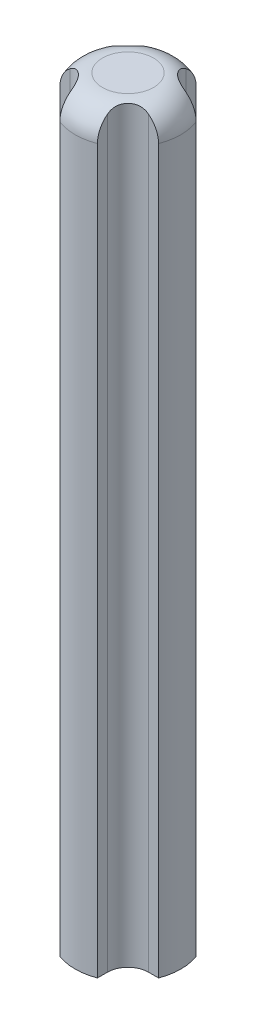
from build123d import *

# Parameters (mm, degrees)
SKETCH1_R           = 3.875
BOSS_EXTRUDE1_DEPTH = 55
FILLET1_R           = 2
SKETCH2_W           = 2.5
SKETCH2_H           = 2.5
CUT_EXTRUDE1_DEPTH  = 56.272337121
CIRPATTERN1_COUNT   = 4
FILLET2_R           = 1.5


with BuildPart() as part:
    # Sketch1 → Boss-Extrude1 (new body)
    with BuildSketch(Plane(origin=(0, 0, 0), x_dir=(1, 0, 0), z_dir=(0, 1, 0))):
        with Locations(Location((0, 0, 0), (0, 0, 270))):
            Circle(SKETCH1_R)
    extrude(amount=BOSS_EXTRUDE1_DEPTH)

    # Fillet1
    fillet1_edges = [part.edges().sort_by_distance(p)[0] for p in [
        (0, 55, -3.875),
    ]]
    fillet(fillet1_edges, radius=FILLET1_R)

    # Sketch2 → Cut-Extrude1 (cut, through all)
    with BuildSketch(Plane(origin=(0, 55, 0), x_dir=(1, 0, 0), z_dir=(0, 1, 0))):
        with Locations((2.628858223, -2.628858223)):
            Rectangle(SKETCH2_W, SKETCH2_H)
    cut_extrude1 = extrude(amount=-CUT_EXTRUDE1_DEPTH, mode=Mode.SUBTRACT)

    # CirPattern1: Cut-Extrude1 ×4 about axis
    cirpattern1_axis = Axis((0, 0, 0), (0, 1, 0))
    for i in range(1, CIRPATTERN1_COUNT):
        add(cut_extrude1.rotate(cirpattern1_axis, i * 360 / CIRPATTERN1_COUNT), mode=Mode.SUBTRACT)

    # Fillet2
    fillet2_edges = [part.edges().sort_by_distance(p)[0] for p in [
        (1.378858223, 27.499296628, -1.378858223),
        (-1.378858223, 27.499296628, -1.378858223),
        (-1.378858223, 27.499296628, 1.378858223),
        (1.378858223, 27.499296628, 1.378858223),
    ]]
    fillet(fillet2_edges, radius=FILLET2_R)


solid = part.part
